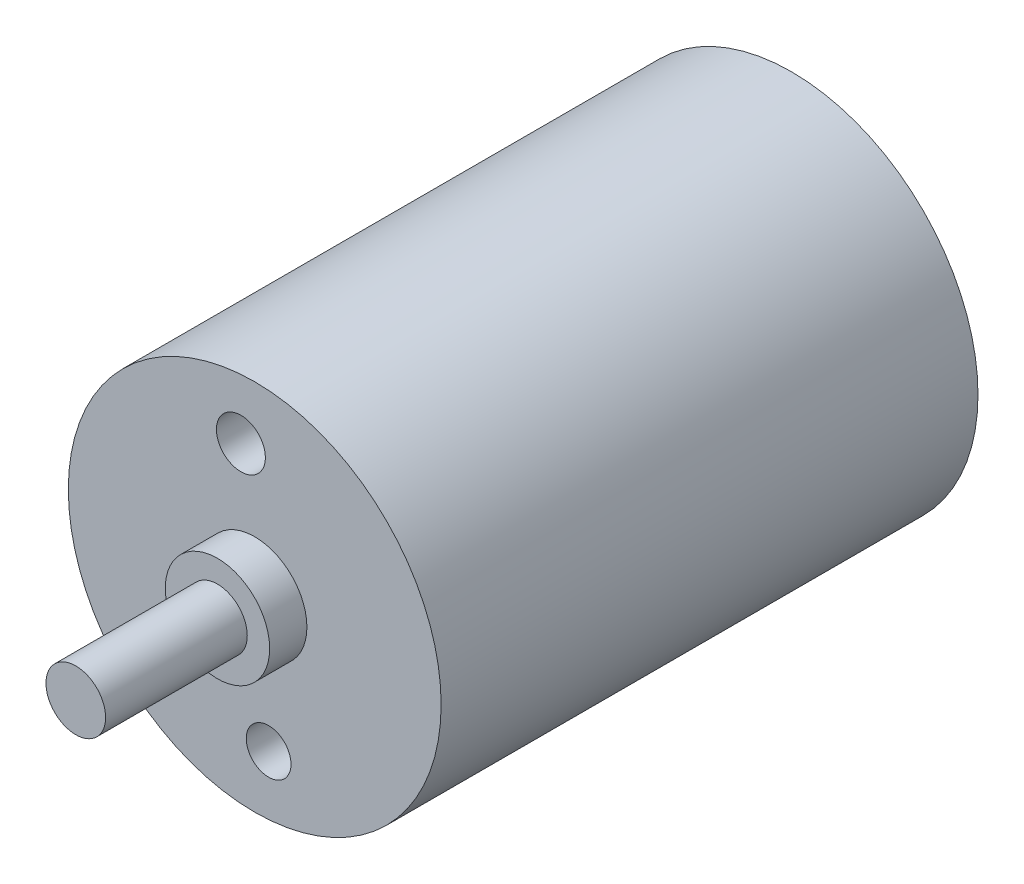
from build123d import *

# Parameters (mm, degrees)
SKETCH1_R           = 12.5
BOSS_EXTRUDE1_DEPTH = 36
SKETCH2_R           = 3.5
BOSS_EXTRUDE2_DEPTH = 2.5
SKETCH3_R           = 2
BOSS_EXTRUDE3_DEPTH = 9.5
SKETCH4_R           = 1.641182994
SKETCH4_R_2         = 1.5
CUT_EXTRUDE1_DEPTH  = 5


with BuildPart() as part:
    # Sketch1 → Boss-Extrude1 (new body)
    with BuildSketch(Plane.XY):
        with Locations((-10.215967641, 3.575588675)):
            Circle(SKETCH1_R)
    extrude(amount=BOSS_EXTRUDE1_DEPTH)

    # Sketch2 → Boss-Extrude2 (add)
    with BuildSketch(Plane.XY.offset(36)):
        with Locations((-10.215967641, 3.575588675)):
            Circle(SKETCH2_R)
    extrude(amount=BOSS_EXTRUDE2_DEPTH)

    # Sketch3 → Boss-Extrude3 (add)
    with BuildSketch(Plane.XY.offset(38.5)):
        with Locations((-10.215967641, 3.575588675)):
            Circle(SKETCH3_R)
    extrude(amount=BOSS_EXTRUDE3_DEPTH)

    # Sketch4 → Cut-Extrude1 (cut)
    with BuildSketch(Plane.XY.offset(36)):
        with Locations((-11.143331912, 12.024848731)):
            Circle(SKETCH4_R)
        with Locations((-9.283034314, -4.924411325)):
            Circle(SKETCH4_R_2)
    extrude(amount=-CUT_EXTRUDE1_DEPTH, mode=Mode.SUBTRACT)


solid = part.part
